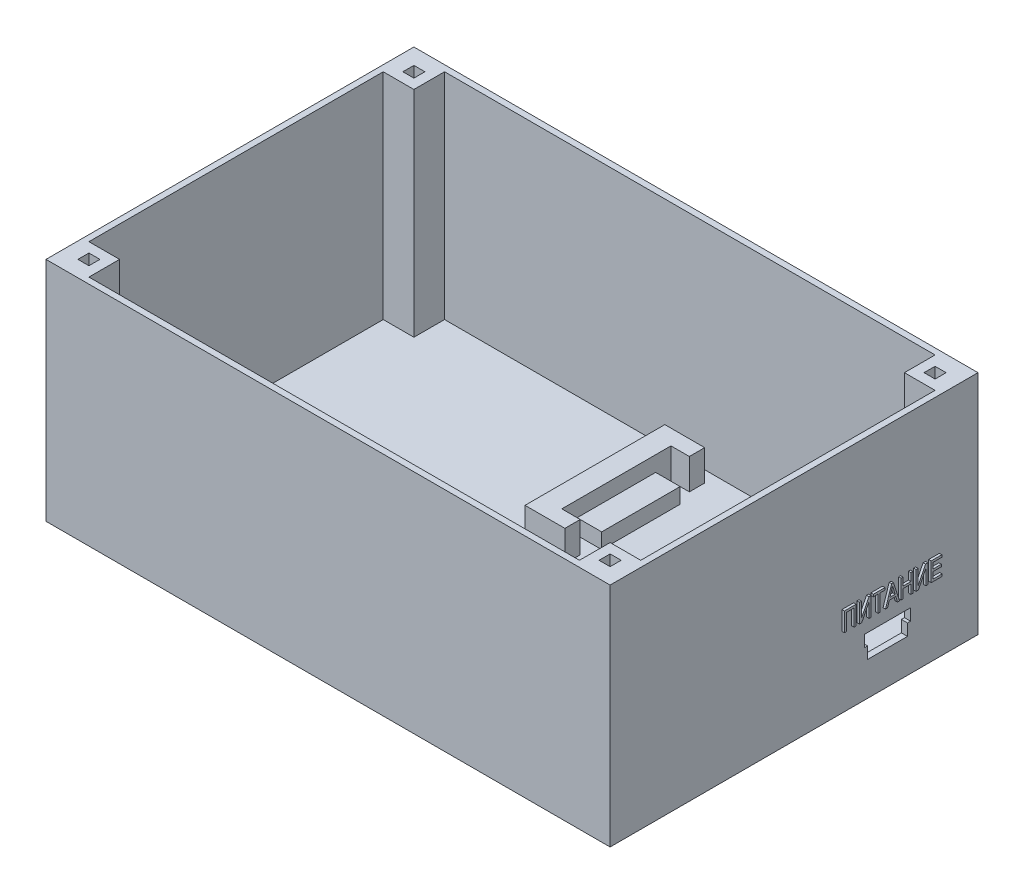
from build123d import *

# Parameters (mm, degrees)
SKETCH_2_W          = 92
SKETCH_2_H          = 60
EXTRUDE_1_DEPTH     = 2
SKETCH_14_W         = 92
SKETCH_14_H         = 60
SKETCH_14_W_2       = 90
SKETCH_14_H_2       = 58
EXTRUDE_9_DEPTH     = 35
SKETCH_18_W         = 4
SKETCH_18_H         = 12.8
EXTRUDE_12_DEPTH    = 2.5
SKETCH_20_W         = 3.5
SKETCH_20_H         = 17.8
EXTRUDE_14_DEPTH    = 5
CUT_EXTRUDE_1_DEPTH = 5
SKETCH_21_W         = 2.706084524
SKETCH_21_H         = 20.3
EXTRUDE_16_DEPTH    = 2.5
SKETCH_22_W         = 2.706084524
SKETCH_22_H         = 2.5
EXTRUDE_17_DEPTH    = 5
SKETCH_16_W         = 5
SKETCH_16_H         = 5
SKETCH_16_W_2       = 1.8
SKETCH_16_H_2       = 1.8
EXTRUDE_19_DEPTH    = 35
EXTRUDE_20_DEPTH    = 0.4
SKETCH_24_W         = 9.7
SKETCH_24_H         = 4.6
CUT_EXTRUDE_2_DEPTH = 1
EXTRUDE_21_DEPTH    = 0.4
SKETCH_26_W         = 6.5
SKETCH_26_H         = 2.5
EXTRUDE_22_DEPTH    = 5


with BuildPart() as part:
    # Эскиз2 → Бобышка-Вытянуть1 (new body)
    with BuildSketch(Plane(origin=(0, 0, 0), x_dir=(1, 0, 0), z_dir=(0, 1, 0))):
        with Locations((46, 30)):
            Rectangle(SKETCH_2_W, SKETCH_2_H)
    extrude(amount=EXTRUDE_1_DEPTH)



with BuildPart() as body_2:
    # Эскиз14 → Бобышка-Вытянуть9 (new body)
    with BuildSketch(Plane(origin=(0, 2, 0), x_dir=(1, 0, 0), z_dir=(0, 1, 0))):
        with Locations((46, 30)):
            Rectangle(SKETCH_14_W, SKETCH_14_H)
        with Locations((46, 30)):
            Rectangle(SKETCH_14_W_2, SKETCH_14_H_2, mode=Mode.SUBTRACT)
    extrude(amount=EXTRUDE_9_DEPTH)


with BuildPart() as part_1:
    add(part.part)

    add(body_2.part)  # Бобышка-Вытянуть12 merges body 2
    # Эскиз18 → Бобышка-Вытянуть12 (add)
    with BuildSketch(Plane(origin=(0, 2, 0), x_dir=(1, 0, 0), z_dir=(0, 1, 0))):
        with Locations((49.3, 45.72407939)):
            Rectangle(SKETCH_18_W, SKETCH_18_H)
    extrude(amount=EXTRUDE_12_DEPTH)

    # Эскиз20 → Бобышка-Вытянуть14 (add)
    with BuildSketch(Plane(origin=(0, 2, 0), x_dir=(1, 0, 0), z_dir=(0, 1, 0))):
        with Locations((45.55, 45.72407939)):
            Rectangle(SKETCH_20_W, SKETCH_20_H)
    extrude(amount=EXTRUDE_14_DEPTH)

    # Эскиз17 → Вырез-Вытянуть1 (cut)
    with BuildSketch(Plane(origin=(92, 0, 0), x_dir=(0, 0, -1), z_dir=(1, 0, 0))):
        Polygon((41.5, 9.3), (49, 9.3), (49, 7.4), (48.5, 7.4), (48.5, 5.5), (42, 5.5), (42, 7.4), (41.5, 7.4), align=None)
    extrude(amount=-CUT_EXTRUDE_1_DEPTH, mode=Mode.SUBTRACT)

    # Эскиз21 → Бобышка-Вытянуть16 (add)
    with BuildSketch(Plane(origin=(0, 2, 0), x_dir=(1, 0, 0), z_dir=(0, 1, 0))):
        with Locations((2.353042262, 16.15)):
            Rectangle(SKETCH_21_W, SKETCH_21_H)
        with Locations((89.646957738, 16.15)):
            Rectangle(SKETCH_21_W, SKETCH_21_H)
    extrude(amount=EXTRUDE_16_DEPTH)

    # Эскиз22 → Бобышка-Вытянуть17 (add)
    with BuildSketch(Plane(origin=(0, 2, 0), x_dir=(1, 0, 0), z_dir=(0, 1, 0))):
        with Locations((2.353042262, 27.55)):
            Rectangle(SKETCH_22_W, SKETCH_22_H)
        with Locations((89.646957738, 27.55)):
            Rectangle(SKETCH_22_W, SKETCH_22_H)
    extrude(amount=EXTRUDE_17_DEPTH)

    # Эскиз16 → Бобышка-Вытянуть19 (add)
    # profile 1 of 4: a face of its own
    with BuildSketch(Plane(origin=(0, 2, 0), x_dir=(1, 0, 0), z_dir=(0, 1, 0))):
        with Locations((3.5, 56.5)):
            Rectangle(SKETCH_16_W, SKETCH_16_H)
        with Locations((3.5, 56.5)):
            Rectangle(SKETCH_16_W_2, SKETCH_16_H_2, mode=Mode.SUBTRACT)
    # profile 2 of 4: a face of its own
    with BuildSketch(Plane(origin=(0, 2, 0), x_dir=(1, 0, 0), z_dir=(0, 1, 0))):
        with Locations((88.5, 3.5)):
            Rectangle(SKETCH_16_W, SKETCH_16_H)
        with Locations((88.5, 3.5)):
            Rectangle(SKETCH_16_W_2, SKETCH_16_H_2, mode=Mode.SUBTRACT)
    # profile 3 of 4: a face of its own
    with BuildSketch(Plane(origin=(0, 2, 0), x_dir=(1, 0, 0), z_dir=(0, 1, 0))):
        with Locations((3.5, 3.5)):
            Rectangle(SKETCH_16_W, SKETCH_16_H)
        with Locations((3.5, 3.5)):
            Rectangle(SKETCH_16_W_2, SKETCH_16_H_2, mode=Mode.SUBTRACT)
    # profile 4 of 4: a face of its own
    with BuildSketch(Plane(origin=(0, 2, 0), x_dir=(1, 0, 0), z_dir=(0, 1, 0))):
        with Locations((88.5, 56.5)):
            Rectangle(SKETCH_16_W, SKETCH_16_H)
        with Locations((88.5, 56.5)):
            Rectangle(SKETCH_16_W_2, SKETCH_16_H_2, mode=Mode.SUBTRACT)
    extrude(amount=EXTRUDE_19_DEPTH)

    # Эскиз23 → Бобышка-Вытянуть20 (add)
    # profile 1 of 7: a face of its own
    with BuildSketch(Plane(origin=(92, 0, 0), x_dir=(0, 0, -1), z_dir=(1, 0, 0))):
        Polygon((37.820297464, 14.633638566), (39.716902031, 14.633638566), (39.716902031, 11.551656144), (39.40080127, 11.551656144), (39.40080127, 14.278025209), (38.136398225, 14.278025209), (38.136398225, 11.551656144), (37.820297464, 11.551656144), align=None)
    # profile 2 of 7: a face of its own
    with BuildSketch(Plane(origin=(92, 0, 0), x_dir=(0, 0, -1), z_dir=(1, 0, 0))):
        Polygon((40.270078363, 14.633638566), (40.586179124, 14.633638566), (40.586179124, 12.193118431), (41.807982653, 14.633638566), (42.166682931, 14.633638566), (42.166682931, 11.551656144), (41.850582169, 11.551656144), (41.850582169, 13.986002436), (40.631248178, 11.551656144), (40.270078363, 11.551656144), align=None)
    # profile 3 of 7: a face of its own
    with BuildSketch(Plane(origin=(92, 0, 0), x_dir=(0, 0, -1), z_dir=(1, 0, 0))):
        Polygon((43.31254819, 11.551656144), (43.31254819, 14.278025209), (42.522296287, 14.278025209), (42.522296287, 14.633638566), (44.418900854, 14.633638566), (44.418900854, 14.278025209), (43.628648951, 14.278025209), (43.628648951, 11.551656144), align=None)
    # profile 4 of 7: a face of its own
    with BuildSketch(Plane(origin=(92, 0, 0), x_dir=(0, 0, -1), z_dir=(1, 0, 0))):
        Polygon((44.516447573, 11.551656144), (45.514757985, 14.633638566), (45.812954602, 14.633638566), (46.811265014, 11.551656144), (46.473555802, 11.551656144), (46.192028562, 12.499958427), (45.135066641, 12.499958427), (44.853539401, 11.551656144), align=None)
        with BuildLine():
            Line((45.240639357, 12.855571784), (46.086455846, 12.855571784))
            Line((46.086455846, 12.855571784), (45.84567597, 13.664345216))
            add(Edge.make_bspline(
                [(45.84567597, 13.664345216), (45.836426209, 13.695629271), (45.81840739, 13.756571573), (45.791917269, 13.845492472), (45.766358364, 13.929527401), (45.743018253, 14.008795057), (45.721701904, 14.083295859), (45.700236272, 14.152384308), (45.681371857, 14.216880949), (45.669307011, 14.258268151), (45.663547602, 14.278025209)],
                knots=[0, 0, 0, 0, 1.223089462, 2.382615935, 3.47858657, 4.516186366, 5.480638401, 6.383728134, 7.228438372, 8, 8, 8, 8], degree=3))
            add(Edge.make_bspline(
                [(45.663547602, 14.278025209), (45.635377776, 14.18294088), (45.578724644, 13.9917141), (45.521779603, 13.800574044), (45.493149535, 13.704475195)],
                knots=[0, 0, 0, 0, 0.994466669, 2, 2, 2, 2], degree=3))
            Line((45.493149535, 13.704475195), (45.240639357, 12.855571784))
        make_face(mode=Mode.SUBTRACT)
    # profile 5 of 7: a face of its own
    with BuildSketch(Plane(origin=(92, 0, 0), x_dir=(0, 0, -1), z_dir=(1, 0, 0))):
        Polygon((47.066244729, 11.551656144), (47.066244729, 14.633638566), (47.382345491, 14.633638566), (47.382345491, 13.369235521), (48.646748535, 13.369235521), (48.646748535, 14.633638566), (48.962849297, 14.633638566), (48.962849297, 11.551656144), (48.646748535, 11.551656144), (48.646748535, 13.013622164), (47.382345491, 13.013622164), (47.382345491, 11.551656144), align=None)
    # profile 6 of 7: a face of its own
    with BuildSketch(Plane(origin=(92, 0, 0), x_dir=(0, 0, -1), z_dir=(1, 0, 0))):
        Polygon((49.516025629, 14.633638566), (49.83212639, 14.633638566), (49.83212639, 12.193118431), (51.053929918, 14.633638566), (51.412630196, 14.633638566), (51.412630196, 11.551656144), (51.096529435, 11.551656144), (51.096529435, 13.986002436), (49.877195444, 11.551656144), (49.516025629, 11.551656144), align=None)
    # profile 7 of 7: a face of its own
    with BuildSketch(Plane(origin=(92, 0, 0), x_dir=(0, 0, -1), z_dir=(1, 0, 0))):
        Polygon((51.965806528, 11.551656144), (51.965806528, 14.633638566), (53.704360715, 14.633638566), (53.704360715, 14.278025209), (52.28190729, 14.278025209), (52.28190729, 13.329722926), (53.625335525, 13.329722926), (53.625335525, 12.974109569), (52.28190729, 12.974109569), (52.28190729, 11.9072695), (53.74387331, 11.9072695), (53.74387331, 11.551656144), align=None)
    extrude(amount=EXTRUDE_20_DEPTH)

    # Эскиз24 → Вырез-Вытянуть2 (cut)
    with BuildSketch(Plane(origin=(1, 0, 0), x_dir=(0, 0, -1), z_dir=(1, 0, 0))):
        with Locations((17.746202532, 11.8)):
            Rectangle(SKETCH_24_W, SKETCH_24_H)
    extrude(amount=-CUT_EXTRUDE_2_DEPTH, mode=Mode.SUBTRACT)

    # Эскиз25 → Бобышка-Вытянуть21 (add)
    # profile 1 of 4: a face of its own
    with BuildSketch(Plane.ZY):
        with BuildLine():
            Line((-21.91266946, 21.587525959), (-21.348566896, 21.587525959))
            Line((-21.348566896, 21.587525959), (-21.348566896, 19.286243907))
            add(Edge.make_bspline(
                [(-21.348566896, 19.286243907), (-21.349152296, 19.237361581), (-21.350291487, 19.142236492), (-21.355532254, 19.003507344), (-21.365741505, 18.872486692), (-21.381371643, 18.749386429), (-21.399041567, 18.633672637), (-21.422575164, 18.525977914), (-21.44956627, 18.425867611), (-21.48062205, 18.332665361), (-21.518212184, 18.245741512), (-21.561159024, 18.163234693), (-21.611241968, 18.084904012), (-21.668331124, 18.010868358), (-21.732729396, 17.941532411), (-21.802678319, 17.875118809), (-21.880024387, 17.81345329), (-21.963916737, 17.755829963), (-22.05445955, 17.703532236), (-22.152049202, 17.658411678), (-22.256566645, 17.621210837), (-22.367539929, 17.589562805), (-22.485523063, 17.566099186), (-22.610137547, 17.548301586), (-22.741548365, 17.537833279), (-22.831454139, 17.536781544), (-22.877413049, 17.536243907)],
                knots=[0, 0, 0, 0, 1.311435591, 2.552055809, 3.723716842, 4.835547674, 5.880436826, 6.862821995, 7.791032428, 8.661143393, 9.495683908, 10.328993084, 11.1538804, 11.986573222, 12.833449924, 13.690091648, 14.571895854, 15.484149563, 16.418232274, 17.373591634, 18.364096258, 19.391643703, 20.466661433, 21.588422397, 22.767226238, 24, 24, 24, 24], degree=3))
            add(Edge.make_bspline(
                [(-22.877413049, 17.536243907), (-22.922297532, 17.536904605), (-23.009751443, 17.538191923), (-23.137907465, 17.546896763), (-23.259812, 17.562322693), (-23.375832956, 17.582566983), (-23.485580893, 17.610003348), (-23.588892874, 17.643585704), (-23.686121619, 17.682868601), (-23.777278753, 17.727563237), (-23.861298634, 17.779165575), (-23.939666638, 17.835491537), (-24.012032366, 17.897154443), (-24.077723568, 17.964710082), (-24.137519084, 18.037141164), (-24.19058553, 18.115221784), (-24.237049976, 18.199091201), (-24.278080798, 18.288528567), (-24.313829847, 18.384850395), (-24.342656463, 18.489369394), (-24.368735909, 18.601817292), (-24.388752416, 18.722602621), (-24.40633476, 18.851573712), (-24.416530876, 18.989111723), (-24.424299296, 19.134980024), (-24.425086211, 19.234949916), (-24.425489973, 19.286243907)],
                knots=[0, 0, 0, 0, 1.192889473, 2.324252067, 3.41162405, 4.457325556, 5.452435892, 6.415456921, 7.342133401, 8.237363544, 9.110250727, 9.959377435, 10.800155199, 11.633438097, 12.46053001, 13.293359256, 14.138649731, 15.005774073, 15.906391469, 16.865847877, 17.8852706, 18.972920589, 20.118424796, 21.343408205, 22.636917643, 24, 24, 24, 24], degree=3))
            Line((-24.425489973, 19.286243907), (-24.425489973, 21.587525959))
            Line((-24.425489973, 21.587525959), (-23.861387408, 21.587525959))
            Line((-23.861387408, 21.587525959), (-23.861387408, 19.312686215))
            add(Edge.make_bspline(
                [(-23.861387408, 19.312686215), (-23.861018817, 19.271284627), (-23.860307614, 19.191399654), (-23.856597014, 19.075677295), (-23.849176462, 18.968287646), (-23.840002694, 18.869066763), (-23.827390461, 18.778372952), (-23.811239141, 18.696339037), (-23.793122729, 18.622685649), (-23.765993641, 18.536551545), (-23.720961921, 18.440400946), (-23.649995151, 18.338489174), (-23.563401579, 18.249952501), (-23.460352664, 18.17683518), (-23.343329045, 18.118738028), (-23.213119591, 18.078679324), (-23.071269065, 18.052917649), (-22.972618471, 18.050379864), (-22.921483562, 18.04906442)],
                knots=[0, 0, 0, 0, 1.090245215, 2.103644224, 3.048223674, 3.924421557, 4.727106666, 5.45815927, 6.12513286, 6.723455763, 7.834131158, 8.905266051, 9.9795367, 11.078391299, 12.21701853, 13.404826756, 14.65480846, 16, 16, 16, 16], degree=3))
            add(Edge.make_bspline(
                [(-22.921483562, 18.04906442), (-22.877657231, 18.04981052), (-22.79303302, 18.051251162), (-22.671007312, 18.062869444), (-22.559138927, 18.084049815), (-22.456499413, 18.111344406), (-22.363811065, 18.14841188), (-22.28050716, 18.193321227), (-22.206879998, 18.246314124), (-22.14240125, 18.308826245), (-22.086844318, 18.383633745), (-22.040019901, 18.472786138), (-22.000131123, 18.576361119), (-21.967442781, 18.694700611), (-21.9436084, 18.82836667), (-21.924976291, 18.976498403), (-21.91520653, 19.139747051), (-21.913539495, 19.253380354), (-21.91266946, 19.312686215)],
                knots=[0, 0, 0, 0, 1.111629428, 2.146443922, 3.104513091, 3.997025448, 4.836178689, 5.630482806, 6.392099463, 7.129930272, 7.899580577, 8.745272349, 9.676297551, 10.710246713, 11.854352966, 13.117392195, 14.495550762, 16, 16, 16, 16], degree=3))
            Line((-21.91266946, 19.312686215), (-21.91266946, 21.587525959))
        make_face()
    # profile 2 of 4: a face of its own
    with BuildSketch(Plane.ZY):
        Polygon((-20.972765614, 17.587525959), (-19.384624588, 21.587525959), (-18.748406639, 21.587525959), (-17.160265614, 17.587525959), (-17.758823306, 17.587525959), (-18.213951511, 18.818295189), (-19.919079716, 18.818295189), (-20.374207921, 17.587525959), align=None)
        with BuildLine():
            Line((-19.749207921, 19.279833651), (-18.383823306, 19.279833651))
            Line((-18.383823306, 19.279833651), (-18.772445101, 20.331115702))
            add(Edge.make_bspline(
                [(-18.772445101, 20.331115702), (-18.787343473, 20.371735808), (-18.816472603, 20.451155784), (-18.859912913, 20.566546306), (-18.89959928, 20.676125881), (-18.938515021, 20.778323296), (-18.973644956, 20.874623071), (-19.006025118, 20.964374744), (-19.038048824, 21.046954499), (-19.057266701, 21.100309529), (-19.066515614, 21.125987497)],
                knots=[0, 0, 0, 0, 1.225184869, 2.395467751, 3.491410812, 4.525364584, 5.492066482, 6.394148129, 7.227157926, 8, 8, 8, 8], degree=3))
            add(Edge.make_bspline(
                [(-19.066515614, 21.125987497), (-19.0818151, 21.06266789), (-19.112477158, 20.93576759), (-19.176676043, 20.749841626), (-19.250117337, 20.565616039), (-19.309760419, 20.446902329), (-19.339752793, 20.387205446)],
                knots=[0, 0, 0, 0, 0.9891762, 1.982431084, 2.985436691, 4, 4, 4, 4], degree=3))
            Line((-19.339752793, 20.387205446), (-19.749207921, 19.279833651))
        make_face(mode=Mode.SUBTRACT)
    # profile 3 of 4: a face of its own
    with BuildSketch(Plane.ZY):
        with BuildLine():
            Line((-16.73318228, 17.587525959), (-16.73318228, 21.587525959))
            Line((-16.73318228, 21.587525959), (-14.997605357, 21.587525959))
            add(Edge.make_bspline(
                [(-14.997605357, 21.587525959), (-14.956737835, 21.587205745), (-14.877643529, 21.586586008), (-14.762940454, 21.582198977), (-14.655876633, 21.572741688), (-14.55625521, 21.562514948), (-14.464093886, 21.546818268), (-14.379487742, 21.528814531), (-14.302306148, 21.507389811), (-14.232204058, 21.482085566), (-14.167164604, 21.453457604), (-14.106877943, 21.41813532), (-14.048838035, 21.379429628), (-13.995198946, 21.333956217), (-13.944545938, 21.28416704), (-13.896925958, 21.229385569), (-13.853043982, 21.169136412), (-13.798920819, 21.082907374), (-13.740857701, 20.968068454), (-13.692482003, 20.821099519), (-13.661290219, 20.667364648), (-13.657952609, 20.562304674), (-13.656259203, 20.509000318)],
                knots=[0, 0, 0, 0, 1.242255013, 2.404239178, 3.487702428, 4.508875116, 5.447164253, 6.327763259, 7.137389581, 7.87956647, 8.591787438, 9.293660819, 10.000726923, 10.709654955, 11.427269343, 12.158170644, 12.913245971, 13.690346794, 15.251572448, 16.809945773, 18.381459854, 20, 20, 20, 20], degree=3))
            add(Edge.make_bspline(
                [(-13.656259203, 20.509000318), (-13.657041934, 20.474783675), (-13.65858788, 20.407203459), (-13.670429985, 20.307842452), (-13.691857318, 20.212907005), (-13.71933365, 20.121565692), (-13.756940365, 20.035112671), (-13.800506112, 19.951782114), (-13.854477879, 19.873863334), (-13.914905241, 19.799281478), (-13.98419922, 19.72963389), (-14.062969395, 19.667433285), (-14.150434934, 19.611483716), (-14.247007766, 19.563328854), (-14.351576239, 19.519313024), (-14.465452401, 19.483869357), (-14.588176658, 19.454926884), (-14.673254817, 19.440911822), (-14.717156639, 19.433679805)],
                knots=[0, 0, 0, 0, 0.982609109, 1.940720374, 2.867584677, 3.775009516, 4.675469332, 5.571146231, 6.471115823, 7.392408543, 8.32534739, 9.286126426, 10.269214477, 11.301811357, 12.381622301, 13.524260118, 14.722474812, 16, 16, 16, 16], degree=3))
            add(Edge.make_bspline(
                [(-14.717156639, 19.433679805), (-14.68495299, 19.417411231), (-14.6237971, 19.386516625), (-14.539126012, 19.33807415), (-14.467353262, 19.288577878), (-14.425771671, 19.253176689), (-14.406259203, 19.23656442)],
                knots=[0, 0, 0, 0, 1.172304973, 2.226249348, 3.167654437, 4, 4, 4, 4], degree=3))
            add(Edge.make_bspline(
                [(-14.406259203, 19.23656442), (-14.368472207, 19.199522121), (-14.290855031, 19.123434607), (-14.183895192, 18.993835281), (-14.080193955, 18.849571345), (-14.017187634, 18.745311309), (-13.984784844, 18.691692625)],
                knots=[0, 0, 0, 0, 0.918110279, 1.885863737, 2.912745394, 4, 4, 4, 4], degree=3))
            Line((-13.984784844, 18.691692625), (-13.328534844, 17.587525959))
            Line((-13.328534844, 17.587525959), (-13.97516946, 17.587525959))
            Line((-13.97516946, 17.587525959), (-14.473566896, 18.432077241))
            add(Edge.make_bspline(
                [(-14.473566896, 18.432077241), (-14.491486764, 18.461709337), (-14.526212526, 18.519131476), (-14.576372646, 18.602993744), (-14.625552995, 18.680202324), (-14.671166926, 18.75296388), (-14.715065532, 18.81995746), (-14.756824647, 18.881415787), (-14.795295043, 18.938145115), (-14.842945602, 19.004192816), (-14.898402938, 19.07727521), (-14.963117844, 19.152536275), (-15.024745622, 19.21254092), (-15.100641369, 19.271381857), (-15.194649732, 19.326417663), (-15.274558616, 19.351705104), (-15.313310485, 19.363968266)],
                knots=[0, 0, 0, 0, 1.130940588, 2.191577161, 3.191089816, 4.120344442, 4.99615009, 5.80661983, 6.546979556, 7.234477901, 8.466216387, 9.541989141, 10.473533583, 11.269175393, 12.675684693, 14, 14, 14, 14], degree=3))
            add(Edge.make_bspline(
                [(-15.313310485, 19.363968266), (-15.329569333, 19.366900289), (-15.366688771, 19.373594185), (-15.429717483, 19.37796598), (-15.506084501, 19.382606054), (-15.56142898, 19.382470858), (-15.591355357, 19.382397753)],
                knots=[0, 0, 0, 0, 0.709978628, 1.620902492, 2.713552433, 4, 4, 4, 4], degree=3))
            Line((-15.591355357, 19.382397753), (-16.169079716, 19.382397753))
            Line((-16.169079716, 19.382397753), (-16.169079716, 17.587525959))
            Line((-16.169079716, 17.587525959), (-16.73318228, 17.587525959))
        make_face()
        with BuildLine():
            Line((-16.169079716, 19.843936215), (-15.097765614, 19.843936215))
            add(Edge.make_bspline(
                [(-15.097765614, 19.843936215), (-15.044045866, 19.844776711), (-14.943621838, 19.846347941), (-14.803194721, 19.859764586), (-14.683519572, 19.881084206), (-14.582230585, 19.912181368), (-14.497131847, 19.955354556), (-14.423119858, 20.007969152), (-14.361614964, 20.073874412), (-14.310449245, 20.148234466), (-14.270677082, 20.230063993), (-14.241987341, 20.316013915), (-14.223209406, 20.405361876), (-14.221319388, 20.466170862), (-14.220361767, 20.496981087)],
                knots=[0, 0, 0, 0, 1.546323217, 2.890706218, 4.056530419, 5.041445823, 5.928701482, 6.793137403, 7.641659452, 8.509781392, 9.383301667, 10.251423607, 11.114044887, 12, 12, 12, 12], degree=3))
            add(Edge.make_bspline(
                [(-14.220361767, 20.496981087), (-14.221106277, 20.519433669), (-14.222564553, 20.563411682), (-14.230209316, 20.627959196), (-14.245072552, 20.689294253), (-14.264699417, 20.747741079), (-14.290924893, 20.802871591), (-14.322079688, 20.85511299), (-14.359256976, 20.904175733), (-14.40184142, 20.950209274), (-14.450736101, 20.992095297), (-14.506585322, 21.02823385), (-14.568948603, 21.058943824), (-14.63789843, 21.083317313), (-14.713217601, 21.102812136), (-14.79533489, 21.115781413), (-14.883874757, 21.125165938), (-14.94522775, 21.125708528), (-14.976772024, 21.125987497)],
                knots=[0, 0, 0, 0, 0.965208469, 1.890559848, 2.786986821, 3.67262109, 4.535197034, 5.405224191, 6.282113641, 7.175449223, 8.095446547, 9.040936516, 10.026471658, 11.075712529, 12.17809725, 13.364958037, 14.645208957, 16, 16, 16, 16], degree=3))
            Line((-14.976772024, 21.125987497), (-16.169079716, 21.125987497))
            Line((-16.169079716, 21.125987497), (-16.169079716, 19.843936215))
        make_face(mode=Mode.SUBTRACT)
    # profile 4 of 4: a face of its own
    with BuildSketch(Plane.ZY):
        Polygon((-11.758823306, 17.587525959), (-11.758823306, 21.125987497), (-13.040874588, 21.125987497), (-13.040874588, 21.587525959), (-9.91266946, 21.587525959), (-9.91266946, 21.125987497), (-11.194720742, 21.125987497), (-11.194720742, 17.587525959), align=None)
    extrude(amount=EXTRUDE_21_DEPTH)

    # Эскиз26 → Бобышка-Вытянуть22 (add)
    with BuildSketch(Plane(origin=(0, 2, 0), x_dir=(1, 0, 0), z_dir=(0, 1, 0))):
        with Locations((47.05, 55.87407939)):
            Rectangle(SKETCH_26_W, SKETCH_26_H)
        with Locations((47.05, 35.57407939)):
            Rectangle(SKETCH_26_W, SKETCH_26_H)
    extrude(amount=EXTRUDE_22_DEPTH)


solid = part_1.part
